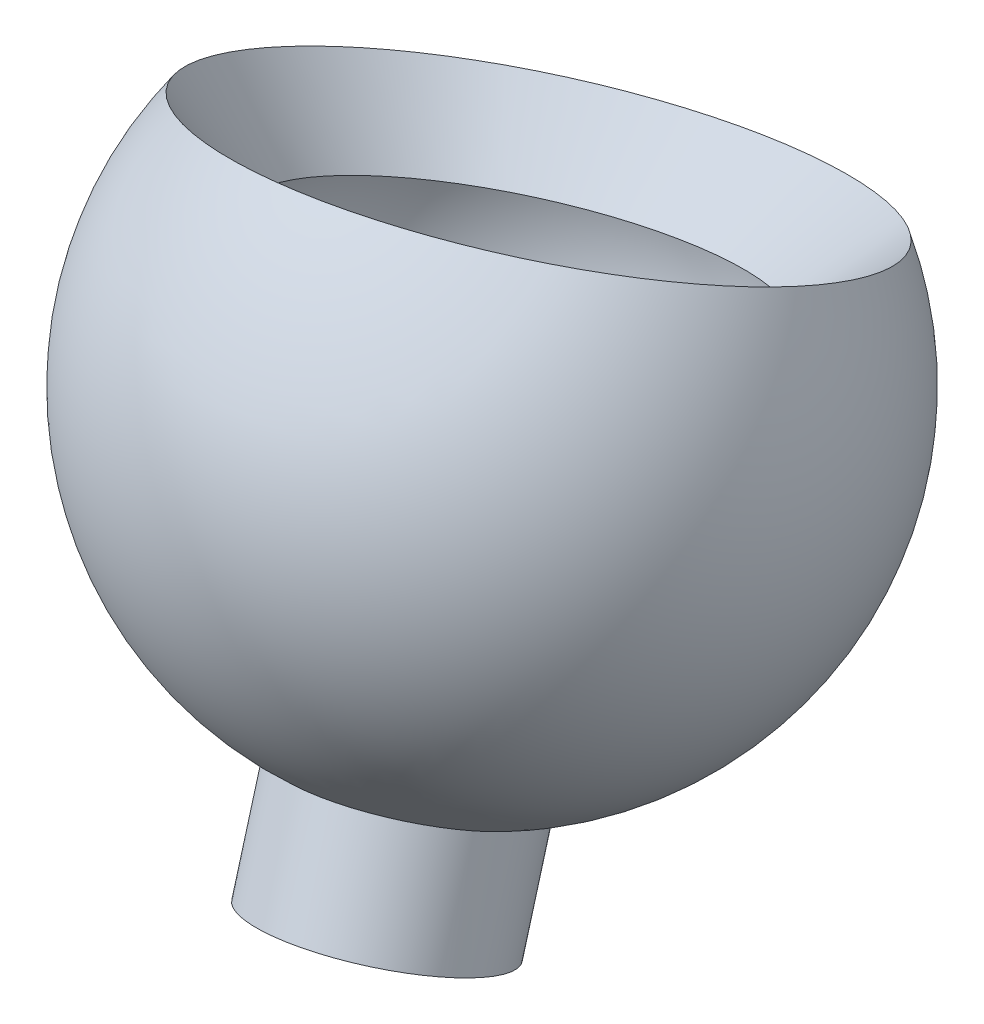
from build123d import *


with BuildPart() as part:
    # Ball socket turned profile → Turned socket body (revolve)
    with BuildSketch(Plane(origin=(0, -6.839373114, 16.171317762), x_dir=(-1, 0, 0), z_dir=(0, 0.3895270342980127, -0.9210150322068553)), mode=Mode.PRIVATE) as turned_socket_body_sk:
        with BuildLine():
            Line((21.450363513, -86.228362345), (21.288694752, -84.679417142))
            Line((21.288694752, -84.679417142), (22.034642647, -84.601559983))
            Line((22.034642647, -84.601559983), (22.283785554, -86.988593249))
            Line((22.283785554, -86.988593249), (23.02973345, -86.91073609))
            Line((23.02973345, -86.91073609), (23.060876313, -87.209115249))
            ThreePointArc((23.060876313, -87.209115249), (20.609484536, -88.906958963), (20.724096138, -91.886700412))
            Line((20.724096138, -91.886700412), (19.804272172, -93.020911066))
            ThreePointArc((19.804272172, -93.020911066), (19.009273884, -89.232523486), (21.450363513, -86.228362345))
        make_face()
    revolve(turned_socket_body_sk.sketch.rotate(Axis((-24.42078135, -99.160389667, -22.874224953), (0.10380954475082833, 0.9160389667138149, 0.3874224953206928)), 90), axis=Axis((-24.42078135, -99.160389667, -22.874224953), (0.10380954475082833, 0.9160389667138149, 0.3874224953206928)))


with BuildPart() as body_2:
    # Mirror1: mirrored copy
    add(part.part.mirror(Plane(origin=(0, 0, 0), x_dir=(0, 0, 1), z_dir=(0, -1, 0))))


solid = body_2.part
